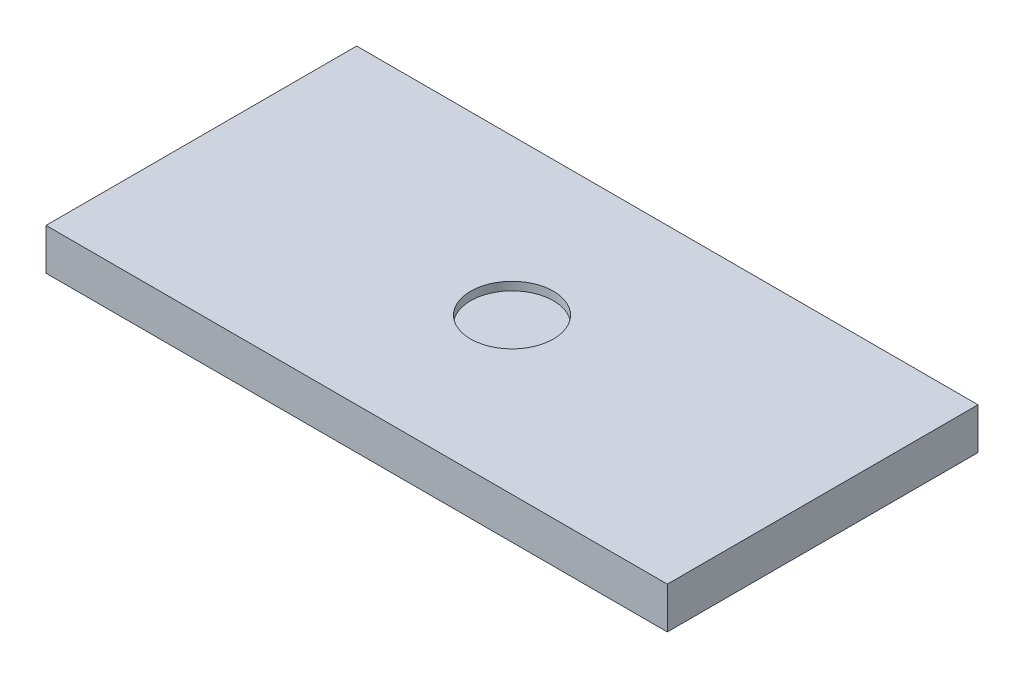
from build123d import *

# Parameters (mm, degrees)
SKETCH_1_W          = 150
SKETCH_1_H          = 75
EXTRUDE_1_DEPTH     = 10
SKETCH_2_R          = 10
CUT_EXTRUDE_1_DEPTH = 2


with BuildPart() as part:
    # 草图1 → 凸台-拉伸1 (new body)
    with BuildSketch(Plane(origin=(0, 0, 0), x_dir=(1, 0, 0), z_dir=(0, 1, 0))):
        Rectangle(SKETCH_1_W, SKETCH_1_H)
    extrude(amount=EXTRUDE_1_DEPTH)

    # 草图2 → 切除-拉伸1 (cut)
    with BuildSketch(Plane(origin=(0, 10, 0), x_dir=(1, 0, 0), z_dir=(0, 1, 0))):
        Circle(SKETCH_2_R)
    extrude(amount=-CUT_EXTRUDE_1_DEPTH, mode=Mode.SUBTRACT)


solid = part.part
